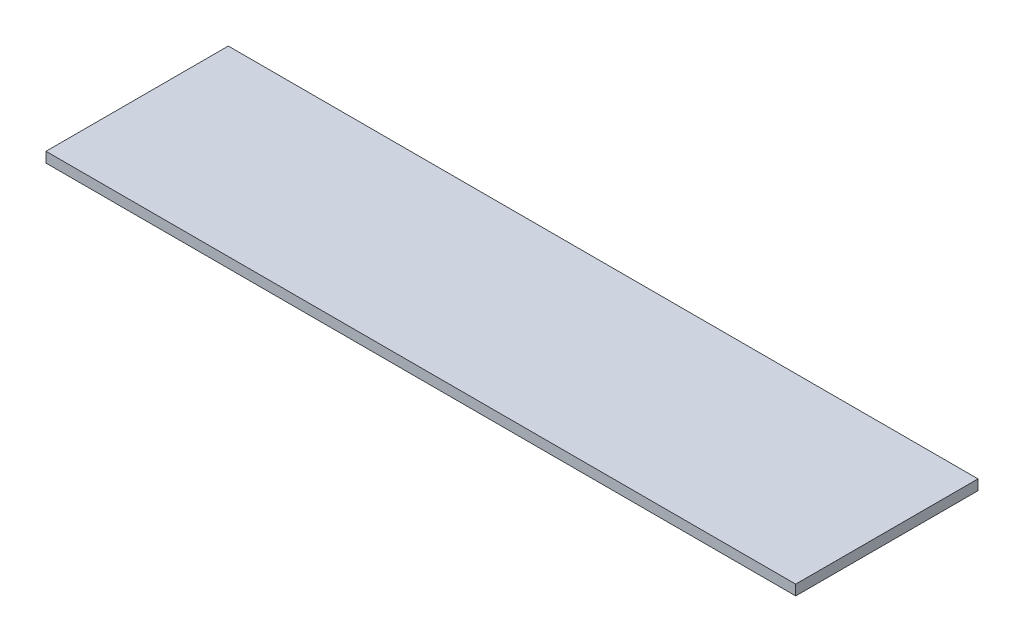
from build123d import *

# Parameters (mm, degrees)
SKETCH1_W           = 463.55
SKETCH1_H           = 112.7125
BOSS_EXTRUDE1_DEPTH = 6.35


with BuildPart() as part:
    # Sketch1 → Boss-Extrude1 (new body)
    with BuildSketch(Plane(origin=(0, 0, 0), x_dir=(1, 0, 0), z_dir=(0, 1, 0))):
        with Locations((151.348065309, 15.265397912)):
            Rectangle(SKETCH1_W, SKETCH1_H)
    extrude(amount=-BOSS_EXTRUDE1_DEPTH)


solid = part.part
